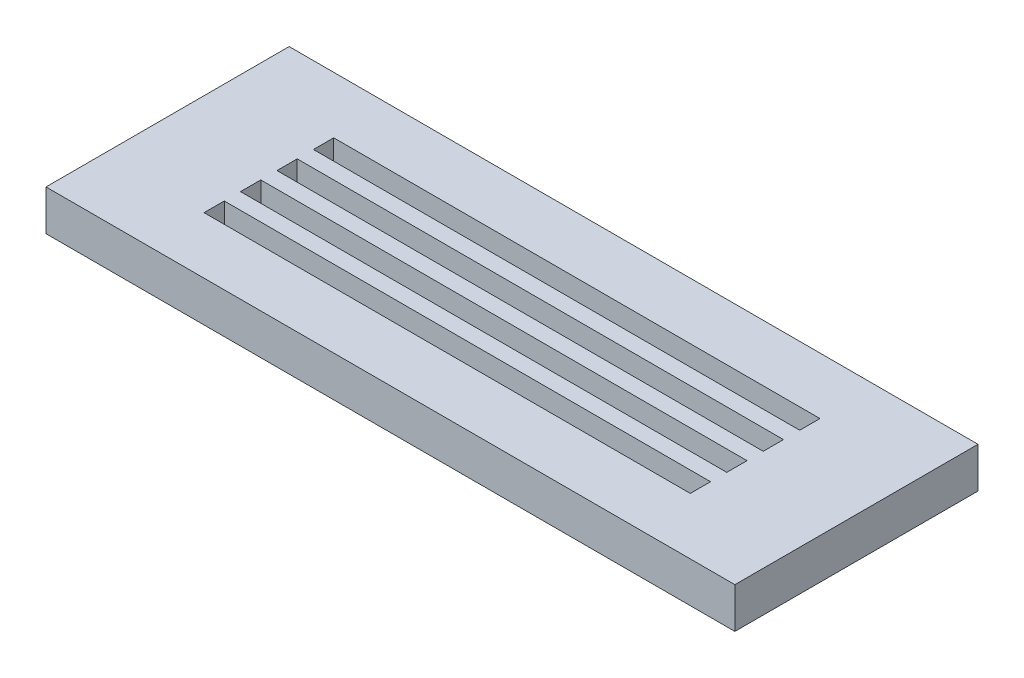
from build123d import *

# Parameters (mm, degrees)
SKETCH1_W           = 85
SKETCH1_H           = 30
BOSS_EXTRUDE1_DEPTH = 5
SKETCH2_W           = 60
SKETCH2_H           = 2.5
CUT_EXTRUDE1_DEPTH  = 5


with BuildPart() as part:
    # Sketch1 → Boss-Extrude1 (new body)
    with BuildSketch(Plane(origin=(0, 0, 0), x_dir=(1, 0, 0), z_dir=(0, 1, 0))):
        with Locations((42.5, 15)):
            Rectangle(SKETCH1_W, SKETCH1_H)
    extrude(amount=BOSS_EXTRUDE1_DEPTH)

    # Sketch2 → Cut-Extrude1 (cut)
    with BuildSketch(Plane(origin=(0, 5, 0), x_dir=(1, 0, 0), z_dir=(0, 1, 0))):
        with Locations((42.5, 21.75)):
            Rectangle(SKETCH2_W, SKETCH2_H)
        with Locations((42.5, 17.25)):
            Rectangle(SKETCH2_W, SKETCH2_H)
        with Locations((42.5, 12.75)):
            Rectangle(SKETCH2_W, SKETCH2_H)
        with Locations((42.5, 8.25)):
            Rectangle(SKETCH2_W, SKETCH2_H)
    extrude(amount=-CUT_EXTRUDE1_DEPTH, mode=Mode.SUBTRACT)


solid = part.part
